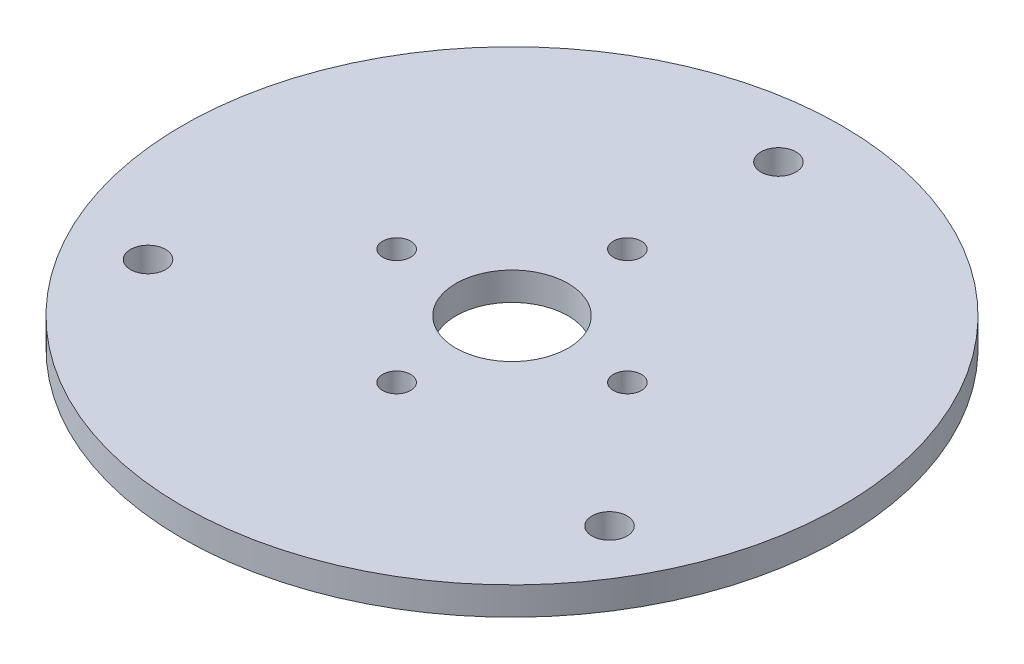
from build123d import *

# Parameters (mm, degrees)
SKETCH1_R           = 23.5
BOSS_EXTRUDE1_DEPTH = 2
SKETCH2_R           = 1
SKETCH2_R_2         = 1.25
CUT_EXTRUDE1_DEPTH  = 34.294143629
CUT_EXTRUDE2_REACH  = 35.294
SKETCH3_R           = 4


with BuildPart() as part:
    # Sketch1 → Boss-Extrude1 (new body)
    with BuildSketch(Plane(origin=(0, 0, 0), x_dir=(1, 0, 0), z_dir=(0, 1, 0))):
        with Locations(Location((0, 0, 0), (0, 0, 270))):
            Circle(SKETCH1_R)
    extrude(amount=BOSS_EXTRUDE1_DEPTH)

    # Sketch2 → Cut-Extrude1 (cut, through all)
    with BuildSketch(Plane(origin=(0, 2, 0), x_dir=(1, 0, 0), z_dir=(0, 1, 0))):
        with Locations(Location((0, 8.227062517, 0), (0, 0, 270))):
            Circle(SKETCH2_R)
        with Locations(Location((8.227062517, 0, 0), (0, 0, 270))):
            Circle(SKETCH2_R)
        with Locations(Location((0, -8.227062517, 0), (0, 0, 270))):
            Circle(SKETCH2_R)
        with Locations(Location((-8.227062517, 0, 0), (0, 0, 270))):
            Circle(SKETCH2_R)
        with Locations(Location((0, 19, 0), (0, 0, 270))):
            Circle(SKETCH2_R_2)
        with Locations(Location((16.454482672, -9.5, 0), (0, 0, 270))):
            Circle(SKETCH2_R_2)
        with Locations(Location((-16.454482672, -9.5, 0), (0, 0, 270))):
            Circle(SKETCH2_R_2)
    extrude(amount=-CUT_EXTRUDE1_DEPTH, mode=Mode.SUBTRACT)

    # Sketch3 → Cut-Extrude2 (cut, up to next)
    with BuildSketch(Plane.XZ, mode=Mode.PRIVATE) as cut_extrude2_sk1:
        with Locations(Location((0, 0, 0), (0, 0, 270))):
            Circle(SKETCH3_R)
    cut_extrude2_tool1 = extrude(cut_extrude2_sk1.sketch, amount=-CUT_EXTRUDE2_REACH, mode=Mode.PRIVATE) & part.part
    add(cut_extrude2_tool1.solids().sort_by_distance((0, 0, 0))[0], mode=Mode.SUBTRACT)


solid = part.part
